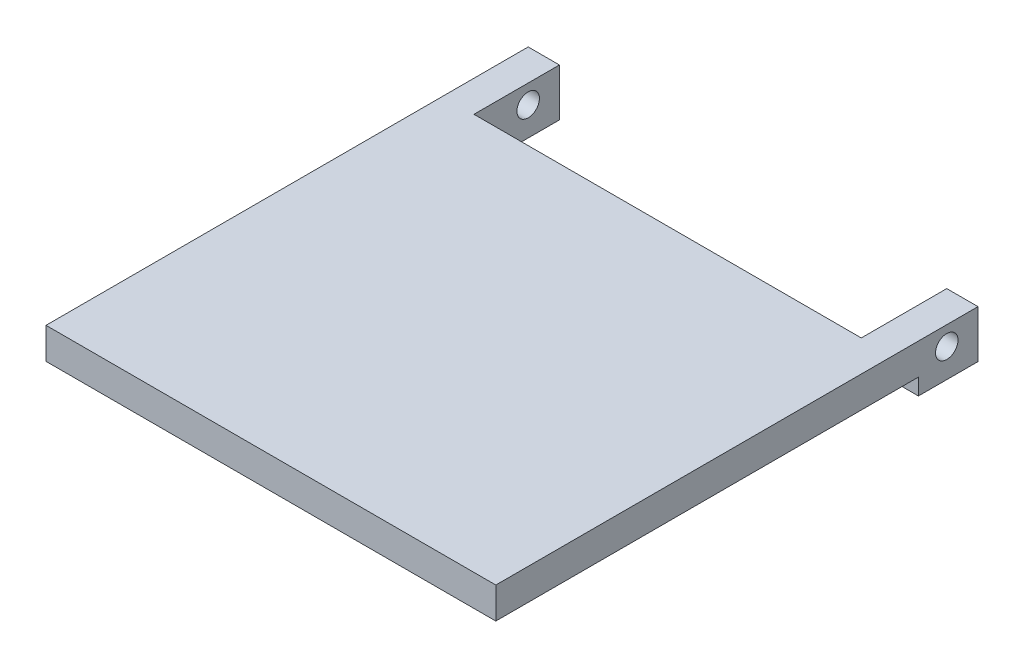
from build123d import *

# Parameters (mm, degrees)
SKETCH1_W           = 72
SKETCH1_H           = 47
SKETCH1_W_2         = 5
SKETCH1_H_2         = 13.68224698
SKETCH1_H_3         = 13
BOSS_EXTRUDE1_DEPTH = 5
SKETCH3_W           = 14.035397612
SKETCH3_H           = 7.623801165
BOSS_EXTRUDE3_DEPTH = 5
SKETCH5_W           = 14.035397612
SKETCH5_H           = 7.623801165
BOSS_EXTRUDE4_DEPTH = 5
SKETCH4_R           = 1.799999998
CUT_EXTRUDE1_DEPTH  = 95
SKETCH6_W           = 72
SKETCH6_H           = 5
BOSS_EXTRUDE5_DEPTH = 21
SKETCH8_W           = 114.485355007
SKETCH8_H           = 45.141194617
CUT_EXTRUDE2_DEPTH  = 4.5
SKETCH9_W           = 62
SKETCH9_H           = 5
CUT_EXTRUDE3_DEPTH  = 4.5


with BuildPart() as part:
    # Sketch1 → Boss-Extrude1 (new body)
    with BuildSketch(Plane(origin=(0, 0, 0), x_dir=(1, 0, 0), z_dir=(0, 1, 0))):
        with Locations((36, -23.5)):
            Rectangle(SKETCH1_W, SKETCH1_H)
        with Locations((69.5, 6.84112349)):
            Rectangle(SKETCH1_W_2, SKETCH1_H_2)
        with Locations((2.5, 6.5)):
            Rectangle(SKETCH1_W_2, SKETCH1_H_3)
    extrude(amount=BOSS_EXTRUDE1_DEPTH)

    # Sketch3 → Boss-Extrude3 (add)
    with BuildSketch(Plane(origin=(72, 0, 0), x_dir=(0, 0, -1), z_dir=(1, 0, 0))):
        with Locations((6.664548174, 1.188099417)):
            Rectangle(SKETCH3_W, SKETCH3_H)
    extrude(amount=-BOSS_EXTRUDE3_DEPTH)

    # Sketch5 → Boss-Extrude4 (add)
    with BuildSketch(Plane.ZY):
        with Locations((-6.664548174, 1.188099417)):
            Rectangle(SKETCH5_W, SKETCH5_H)
    extrude(amount=-BOSS_EXTRUDE4_DEPTH)

    # Sketch4 → Cut-Extrude1 (cut)
    with BuildSketch(Plane(origin=(72, 0, 0), x_dir=(0, 0, -1), z_dir=(1, 0, 0))):
        with Locations((4.182640247, 1.972422216)):
            Circle(SKETCH4_R)
    extrude(amount=-CUT_EXTRUDE1_DEPTH, mode=Mode.SUBTRACT)

    # Sketch6 → Boss-Extrude5 (add)
    with BuildSketch(Plane.XY.offset(47)):
        with Locations((36, 2.5)):
            Rectangle(SKETCH6_W, SKETCH6_H)
    extrude(amount=BOSS_EXTRUDE5_DEPTH)

    # Sketch8 → Cut-Extrude2 (cut)
    with BuildSketch(Plane(origin=(0, 0, -13.68224698), x_dir=(-1, 0, 0), z_dir=(0, 0, -1))):
        with Locations((-40.6465034, -1.597733879)):
            Rectangle(SKETCH8_W, SKETCH8_H)
    extrude(amount=-CUT_EXTRUDE2_DEPTH, mode=Mode.SUBTRACT)

    # Sketch9 → Cut-Extrude3 (cut)
    with BuildSketch(Plane(origin=(0, 0, 0), x_dir=(-1, 0, 0), z_dir=(0, 0, -1))):
        with Locations((-36, 2.5)):
            Rectangle(SKETCH9_W, SKETCH9_H)
    extrude(amount=-CUT_EXTRUDE3_DEPTH, mode=Mode.SUBTRACT)


solid = part.part
